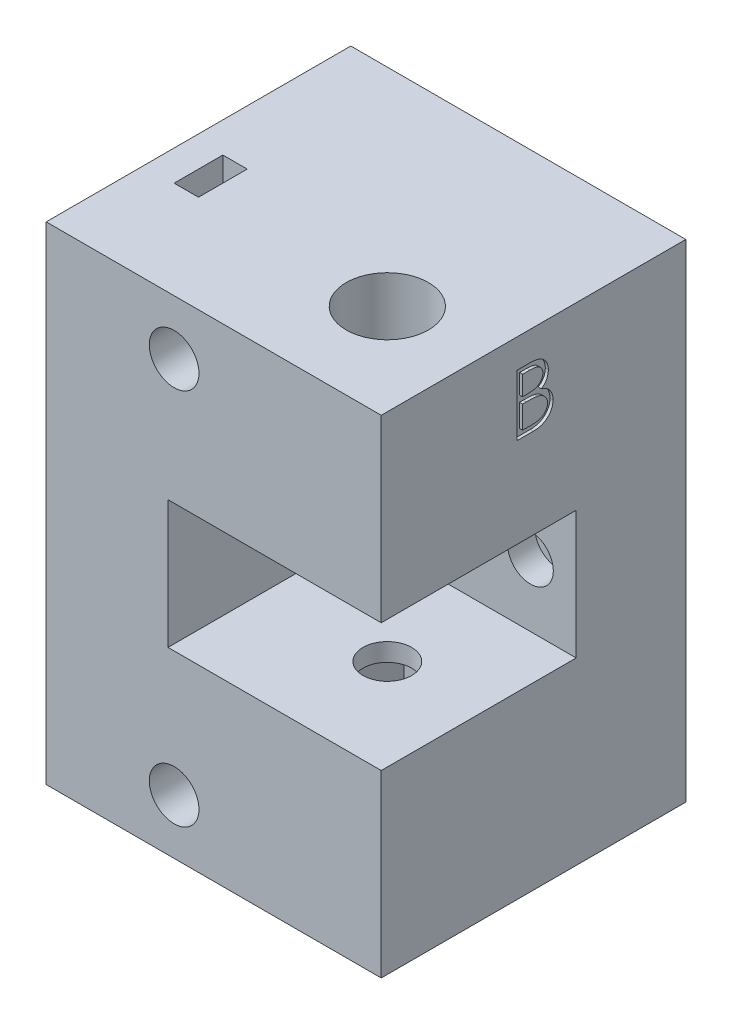
from build123d import *

# Parameters (mm, degrees)
SKETCH2_W           = 55
SKETCH2_H           = 80
BOSS_EXTRUDE1_DEPTH = 50
SKETCH4_R           = 4
CUT_EXTRUDE1_DEPTH  = 110.201648339
SKETCH5_R           = 4.075
CUT_EXTRUDE2_DEPTH  = 8.03
SKETCH6_W           = 35
SKETCH6_H           = 21
CUT_EXTRUDE3_DEPTH  = 32
SKETCH10_R          = 6.75
CUT_EXTRUDE5_DEPTH  = 26.55
CUT_EXTRUDE6_DEPTH  = 26.55
SKETCH12_R          = 2
CUT_EXTRUDE7_DEPTH  = 5
SKETCH13_R          = 2.1
CUT_EXTRUDE8_DEPTH  = 103.220350224
SKETCH13_3_R        = 3.75
CUT_EXTRUDE9_DEPTH  = 4.5
SKETCH14_R          = 2.25
CUT_EXTRUDE10_DEPTH = 10
SKETCH15_W          = 4
SKETCH15_H          = 8
CUT_EXTRUDE11_DEPTH = 13
CUT_EXTRUDE12_DEPTH = 0.5


with BuildPart() as part:
    # Sketch2 → Boss-Extrude1 (new body)
    with BuildSketch(Plane.XY):
        with Locations((27.5, 40)):
            Rectangle(SKETCH2_W, SKETCH2_H)
    extrude(amount=BOSS_EXTRUDE1_DEPTH)

    # Sketch4 → Cut-Extrude1 (cut, through all)
    with BuildSketch(Plane(origin=(0, 80, 0), x_dir=(1, 0, 0), z_dir=(0, 1, 0))):
        with Locations(Location((40, -34, 0), (0, 0, 270))):
            Circle(SKETCH4_R)
    extrude(amount=-CUT_EXTRUDE1_DEPTH, mode=Mode.SUBTRACT)

    # Sketch5 → Cut-Extrude2 (cut)
    with BuildSketch(Plane.XY.offset(50)):
        with Locations((21, 71)):
            Circle(SKETCH5_R)
        with Locations((21, 9)):
            Circle(SKETCH5_R)
    extrude(amount=-CUT_EXTRUDE2_DEPTH, mode=Mode.SUBTRACT)

    # Sketch6 → Cut-Extrude3 (cut)
    with BuildSketch(Plane.XY.offset(50)):
        with Locations((37.5, 40)):
            Rectangle(SKETCH6_W, SKETCH6_H)
    extrude(amount=-CUT_EXTRUDE3_DEPTH, mode=Mode.SUBTRACT)

    # Sketch10 → Cut-Extrude5 (cut)
    with BuildSketch(Plane(origin=(0, 80, 0), x_dir=(1, 0, 0), z_dir=(0, 1, 0))):
        with Locations(Location((40, -34, 0), (0, 0, 270))):
            Circle(SKETCH10_R)
    extrude(amount=-CUT_EXTRUDE5_DEPTH, mode=Mode.SUBTRACT)

    # Sketch11 → Cut-Extrude6 (cut)
    with BuildSketch(Plane.XZ):
        Polygon((47.563288526, 34), (43.781644263, 40.55), (36.218355737, 40.55), (32.436711474, 34), (36.218355737, 27.45), (43.781644263, 27.45), align=None)
    extrude(amount=-CUT_EXTRUDE6_DEPTH, mode=Mode.SUBTRACT)

    # Sketch12 → Cut-Extrude7 (cut)
    with BuildSketch(Plane.XZ):
        with Locations(Location((12.5, 7.5, 0), (0, 0, 270))):
            Circle(SKETCH12_R)
        with Locations(Location((12.5, 22.5, 0), (0, 0, 270))):
            Circle(SKETCH12_R)
    extrude(amount=-CUT_EXTRUDE7_DEPTH, mode=Mode.SUBTRACT)

    # Sketch13 → Cut-Extrude8 (cut, through all)
    with BuildSketch(Plane.XY.offset(18)):
        with Locations((27.5, 40)):
            Circle(SKETCH13_R)
        with Locations((47.5, 40)):
            Circle(SKETCH13_R)
    extrude(amount=-CUT_EXTRUDE8_DEPTH, mode=Mode.SUBTRACT)

    # Sketch13<3> → Cut-Extrude9 (cut)
    with BuildSketch(Plane.XY.offset(18)):
        with Locations((27.5, 40)):
            Circle(SKETCH13_3_R)
        with Locations((47.5, 40)):
            Circle(SKETCH13_3_R)
    extrude(amount=-CUT_EXTRUDE9_DEPTH, mode=Mode.SUBTRACT)

    # Sketch14 → Cut-Extrude10 (cut)
    with BuildSketch(Plane.ZY):
        with Locations((30, 72)):
            Circle(SKETCH14_R)
    extrude(amount=-CUT_EXTRUDE10_DEPTH, mode=Mode.SUBTRACT)

    # Sketch15 → Cut-Extrude11 (cut)
    with BuildSketch(Plane(origin=(0, 80, 0), x_dir=(1, 0, 0), z_dir=(0, 1, 0))):
        with Locations((7, -30)):
            Rectangle(SKETCH15_W, SKETCH15_H)
    extrude(amount=-CUT_EXTRUDE11_DEPTH, mode=Mode.SUBTRACT)

    # Sketch16 → Cut-Extrude12 (cut)
    with BuildSketch(Plane(origin=(55, 0, 0), x_dir=(0, 0, -1), z_dir=(1, 0, 0))):
        with BuildLine():
            Line((-27.692307692, 75.25), (-25.741185897, 75.25))
            add(Edge.make_bspline(
                [(-25.741185897, 75.25), (-25.64567596, 75.249497856), (-25.46055393, 75.248524576), (-25.191355525, 75.233429916), (-24.939216066, 75.212848002), (-24.704062431, 75.180190594), (-24.486003281, 75.140785516), (-24.28438146, 75.093066042), (-24.099838111, 75.035847146), (-23.879516007, 74.944857771), (-23.628314119, 74.809648718), (-23.356318711, 74.609852818), (-23.12373517, 74.365474352), (-22.923202835, 74.089809622), (-22.763771065, 73.78656456), (-22.648430215, 73.462966878), (-22.575407714, 73.123190472), (-22.567897902, 72.88992425), (-22.564102564, 72.772035256)],
                knots=[0, 0, 0, 0, 1.001505555, 1.941167018, 2.826882275, 3.653841531, 4.429895133, 5.150066043, 5.825578002, 6.45369114, 7.647487171, 8.808567382, 9.977351308, 11.170798116, 12.373658725, 13.556498008, 14.765093433, 16, 16, 16, 16], degree=3))
            add(Edge.make_bspline(
                [(-22.564102564, 72.772035256), (-22.567226045, 72.661599383), (-22.573363981, 72.444582477), (-22.632057579, 72.127170736), (-22.723945203, 71.825024397), (-22.851674486, 71.539246153), (-23.01768019, 71.276292972), (-23.214418243, 71.034043641), (-23.451780536, 70.822754907), (-23.629618364, 70.704632328), (-23.719951923, 70.64463141)],
                knots=[0, 0, 0, 0, 1.044552857, 2.05264487, 3.044412934, 4.028983338, 5.005914585, 5.980388656, 6.974128949, 8, 8, 8, 8], degree=3))
            add(Edge.make_bspline(
                [(-23.719951923, 70.64463141), (-23.606350701, 70.601017128), (-23.389003423, 70.517572201), (-23.08990053, 70.370042304), (-22.832200973, 70.209579131), (-22.613923413, 70.034345273), (-22.427244399, 69.845462957), (-22.264235995, 69.640162631), (-22.125146354, 69.415766179), (-22.005966573, 69.174613221), (-21.912970127, 68.919166169), (-21.843324686, 68.651821094), (-21.803417688, 68.373536651), (-21.797738713, 68.184149853), (-21.794871795, 68.088541667)],
                knots=[0, 0, 0, 0, 1.27268992, 2.434971085, 3.483601985, 4.442670788, 5.356604649, 6.2567628, 7.179492994, 8.113709626, 9.066344395, 10.018646069, 10.999752585, 12, 12, 12, 12], degree=3))
            add(Edge.make_bspline(
                [(-21.794871795, 68.088541667), (-21.797662784, 67.990922032), (-21.803154132, 67.798852666), (-21.843668337, 67.516695139), (-21.912265786, 67.247052434), (-22.006754775, 66.988180484), (-22.130075674, 66.740580099), (-22.280155572, 66.503970774), (-22.459102897, 66.280729829), (-22.659282522, 66.06837662), (-22.885745795, 65.877440085), (-23.130076523, 65.707395209), (-23.395351723, 65.567549317), (-23.677214563, 65.45007497), (-23.978826895, 65.360340117), (-24.298834345, 65.297561334), (-24.636960921, 65.255261229), (-24.868988782, 65.2517835), (-24.987980769, 65.25)],
                knots=[0, 0, 0, 0, 0.978564426, 1.925352924, 2.850884081, 3.763762016, 4.682927383, 5.618979971, 6.567305752, 7.547517671, 8.540179244, 9.531824382, 10.526200242, 11.540722885, 12.589160233, 13.674978461, 14.80764778, 16, 16, 16, 16], degree=3))
            Line((-24.987980769, 65.25), (-27.692307692, 65.25))
            Line((-27.692307692, 65.25), (-27.692307692, 75.25))
        make_face()
        with BuildLine():
            Line((-26.794871795, 74.224358974), (-26.794871795, 71.019230769))
            Line((-26.794871795, 71.019230769), (-26.191907051, 71.019230769))
            add(Edge.make_bspline(
                [(-26.191907051, 71.019230769), (-26.103767636, 71.020373406), (-25.933464324, 71.022581214), (-25.686836048, 71.028905549), (-25.457907424, 71.046614244), (-25.247073616, 71.06431785), (-25.054666633, 71.093102386), (-24.881112743, 71.127365595), (-24.72368818, 71.163602466), (-24.542146622, 71.225229572), (-24.336223912, 71.316308644), (-24.116700757, 71.457656747), (-23.923173701, 71.626012042), (-23.759753165, 71.820271932), (-23.626006106, 72.034175321), (-23.533109777, 72.264309265), (-23.470117536, 72.504938213), (-23.464427447, 72.670133221), (-23.461538462, 72.75400641)],
                knots=[0, 0, 0, 0, 1.156816544, 2.235205308, 3.236616184, 4.169592532, 5.011045266, 5.787822928, 6.49130361, 7.128639758, 8.301311294, 9.436451833, 10.541879658, 11.654887649, 12.756523258, 13.837046038, 14.901820046, 16, 16, 16, 16], degree=3))
            add(Edge.make_bspline(
                [(-23.461538462, 72.75400641), (-23.463041833, 72.809508615), (-23.465990862, 72.918382249), (-23.490143155, 73.07709469), (-23.531193368, 73.226362554), (-23.58391992, 73.368231441), (-23.657601887, 73.498265298), (-23.74435464, 73.620960143), (-23.849170898, 73.732137625), (-23.968477505, 73.836050477), (-24.105644999, 73.928177699), (-24.260591547, 74.008865594), (-24.435413482, 74.073839242), (-24.627164496, 74.130742534), (-24.838796175, 74.170709088), (-25.067866327, 74.204004482), (-25.316251239, 74.220955173), (-25.488094389, 74.223199067), (-25.576923077, 74.224358974)],
                knots=[0, 0, 0, 0, 0.91205012, 1.789085906, 2.630437955, 3.453916878, 4.269457761, 5.079663411, 5.91843418, 6.774407191, 7.675494373, 8.627863946, 9.638891023, 10.736472738, 11.911756761, 13.175263542, 14.539845004, 16, 16, 16, 16], degree=3))
            Line((-25.576923077, 74.224358974), (-26.794871795, 74.224358974))
        make_face(mode=Mode.SUBTRACT)
        with BuildLine():
            Line((-26.794871795, 69.993589744), (-26.794871795, 66.275641026))
            Line((-26.794871795, 66.275641026), (-25.516826923, 66.275641026))
            add(Edge.make_bspline(
                [(-25.516826923, 66.275641026), (-25.425344278, 66.276737447), (-25.249023539, 66.278850654), (-24.994448596, 66.285749381), (-24.75849687, 66.301441598), (-24.542245054, 66.326144025), (-24.343358047, 66.352939594), (-24.164221752, 66.388971825), (-24.003384057, 66.43025457), (-23.816886034, 66.49406649), (-23.606876011, 66.593199265), (-23.380559278, 66.742668483), (-23.179341512, 66.920735076), (-23.008469343, 67.126823403), (-22.868432233, 67.350912908), (-22.766559504, 67.588471051), (-22.703728485, 67.835572558), (-22.696122287, 68.004048879), (-22.692307692, 68.088541667)],
                knots=[0, 0, 0, 0, 1.160039823, 2.235823828, 3.228722157, 4.157150951, 4.99529583, 5.772374946, 6.472645482, 7.099169577, 8.269452708, 9.405989375, 10.527446681, 11.663510218, 12.788923519, 13.866172445, 14.929861265, 16, 16, 16, 16], degree=3))
            add(Edge.make_bspline(
                [(-22.692307692, 68.088541667), (-22.693096562, 68.141379782), (-22.694661576, 68.24620373), (-22.718263333, 68.400248928), (-22.752588676, 68.549465709), (-22.796964201, 68.694259253), (-22.86159125, 68.832011757), (-22.937038521, 68.965447641), (-23.025499669, 69.094743297), (-23.163340143, 69.258206878), (-23.363831527, 69.446541201), (-23.648708028, 69.630934064), (-23.97262888, 69.779642085), (-24.207564574, 69.842783446), (-24.328926282, 69.875400641)],
                knots=[0, 0, 0, 0, 0.723448775, 1.435228256, 2.130040452, 2.821711965, 3.505591119, 4.210454504, 4.921174351, 5.648778258, 7.137944449, 8.670945889, 10.280296675, 12, 12, 12, 12], degree=3))
            add(Edge.make_bspline(
                [(-24.328926282, 69.875400641), (-24.377580842, 69.885272309), (-24.483073963, 69.906676123), (-24.655095621, 69.929269561), (-24.851483818, 69.949398304), (-25.072692039, 69.964287326), (-25.319000156, 69.97967745), (-25.590934209, 69.985662653), (-25.88738368, 69.992803396), (-26.093076172, 69.993320923), (-26.199919872, 69.993589744)],
                knots=[0, 0, 0, 0, 0.634451884, 1.375622551, 2.216452059, 3.157844607, 4.20941857, 5.370758133, 6.634282058, 8, 8, 8, 8], degree=3))
            Line((-26.199919872, 69.993589744), (-26.794871795, 69.993589744))
        make_face(mode=Mode.SUBTRACT)
    extrude(amount=-CUT_EXTRUDE12_DEPTH, mode=Mode.SUBTRACT)


solid = part.part
